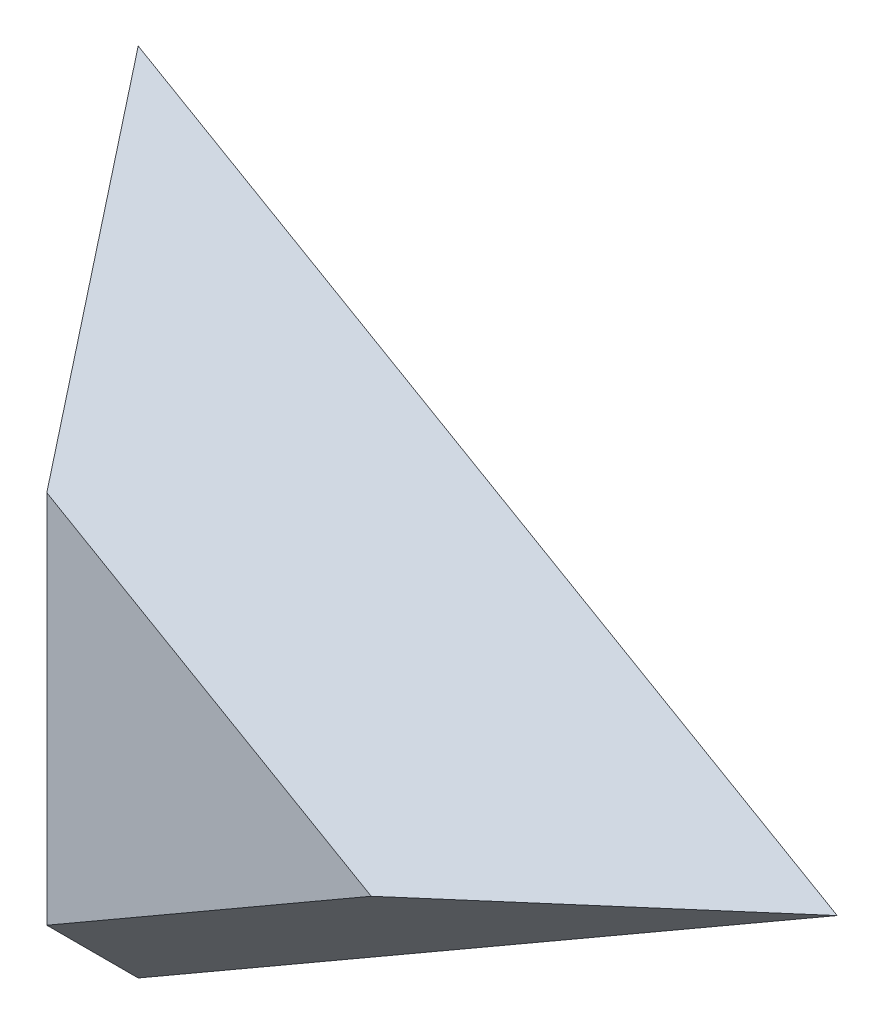
from build123d import *

# Parameters (mm, degrees)
EXTRUDE_2_DEPTH = 15
DRAFT_3_ANGLE   = 30


with BuildPart() as part:
    # 草图1 → 凸台-拉伸2 (new, symmetric)
    with BuildSketch(Plane.XY):
        Polygon((30, 0), (-15, 25.980762114), (-15, -25.980762114), align=None)
    extrude(amount=EXTRUDE_2_DEPTH, both=True)

    # 拔模3
    draft_3_faces = [part.faces().sort_by_distance(p)[0] for p in [
        (7.5, -12.990381057, 0),
        (-15, 0, 0),
        (7.5, 12.990381057, 0),
    ]]
    draft(draft_3_faces, Plane.XY.offset(15), DRAFT_3_ANGLE)


solid = part.part
